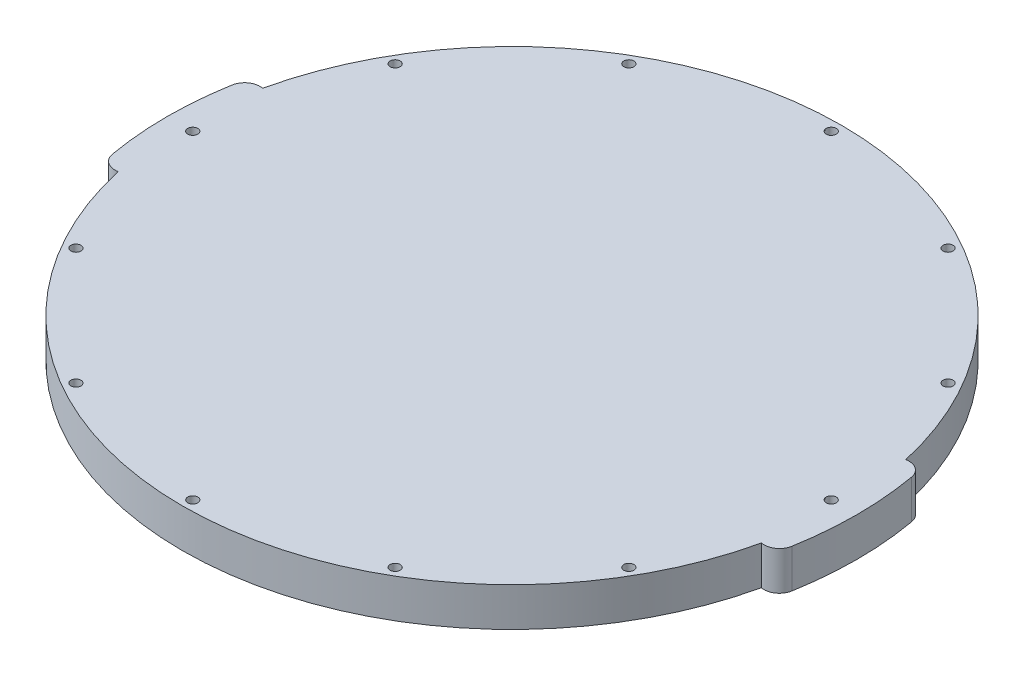
from build123d import *

# Parameters (mm, degrees)
SKETCH1_R           = 1.65
BOSS_EXTRUDE1_DEPTH = 12.7


with BuildPart() as part:
    # Sketch1 → Boss-Extrude1 (new body)
    with BuildSketch(Plane(origin=(0, 0, 0), x_dir=(1, 0, 0), z_dir=(0, 1, 0))):
        with BuildLine():
            ThreePointArc((-111.234035703, -19.613561667), (-112.95, 0), (-111.234035703, 19.613561667))
            ThreePointArc((-111.234035703, 19.613561667), (-109.13025705, 22.87401705), (-105.327953741, 23.647931427))
            ThreePointArc((-105.327953741, 23.647931427), (0, 107.95), (105.327953741, 23.647931427))
            ThreePointArc((105.327953741, 23.647931427), (109.13025705, 22.87401705), (111.234035703, 19.613561667))
            ThreePointArc((111.234035703, 19.613561667), (112.95, 0), (111.234035703, -19.613561667))
            ThreePointArc((111.234035703, -19.613561667), (109.13025705, -22.87401705), (105.327953741, -23.647931427))
            ThreePointArc((105.327953741, -23.647931427), (0, -107.95), (-105.327953741, -23.647931427))
            ThreePointArc((-105.327953741, -23.647931427), (-109.13025705, -22.87401705), (-111.234035703, -19.613561667))
        make_face()
        with Locations(Location((0, 104.55, 0), (0, 0, 270))):
            Circle(SKETCH1_R, mode=Mode.SUBTRACT)
        with Locations(Location((52.275, 90.542955966, 0), (0, 0, 270))):
            Circle(SKETCH1_R, mode=Mode.SUBTRACT)
        with Locations(Location((90.542955966, 52.275, 0), (0, 0, 270))):
            Circle(SKETCH1_R, mode=Mode.SUBTRACT)
        with Locations(Location((104.55, 0, 0), (0, 0, 270))):
            Circle(SKETCH1_R, mode=Mode.SUBTRACT)
        with Locations(Location((90.542955966, -52.275, 0), (0, 0, 270))):
            Circle(SKETCH1_R, mode=Mode.SUBTRACT)
        with Locations(Location((52.275, -90.542955966, 0), (0, 0, 270))):
            Circle(SKETCH1_R, mode=Mode.SUBTRACT)
        with Locations(Location((0, -104.55, 0), (0, 0, 270))):
            Circle(SKETCH1_R, mode=Mode.SUBTRACT)
        with Locations(Location((-52.275, -90.542955966, 0), (0, 0, 270))):
            Circle(SKETCH1_R, mode=Mode.SUBTRACT)
        with Locations(Location((-90.542955966, -52.275, 0), (0, 0, 270))):
            Circle(SKETCH1_R, mode=Mode.SUBTRACT)
        with Locations(Location((-104.55, 0, 0), (0, 0, 270))):
            Circle(SKETCH1_R, mode=Mode.SUBTRACT)
        with Locations(Location((-90.542955966, 52.275, 0), (0, 0, 270))):
            Circle(SKETCH1_R, mode=Mode.SUBTRACT)
        with Locations(Location((-52.275, 90.542955966, 0), (0, 0, 270))):
            Circle(SKETCH1_R, mode=Mode.SUBTRACT)
    extrude(amount=BOSS_EXTRUDE1_DEPTH)


solid = part.part
